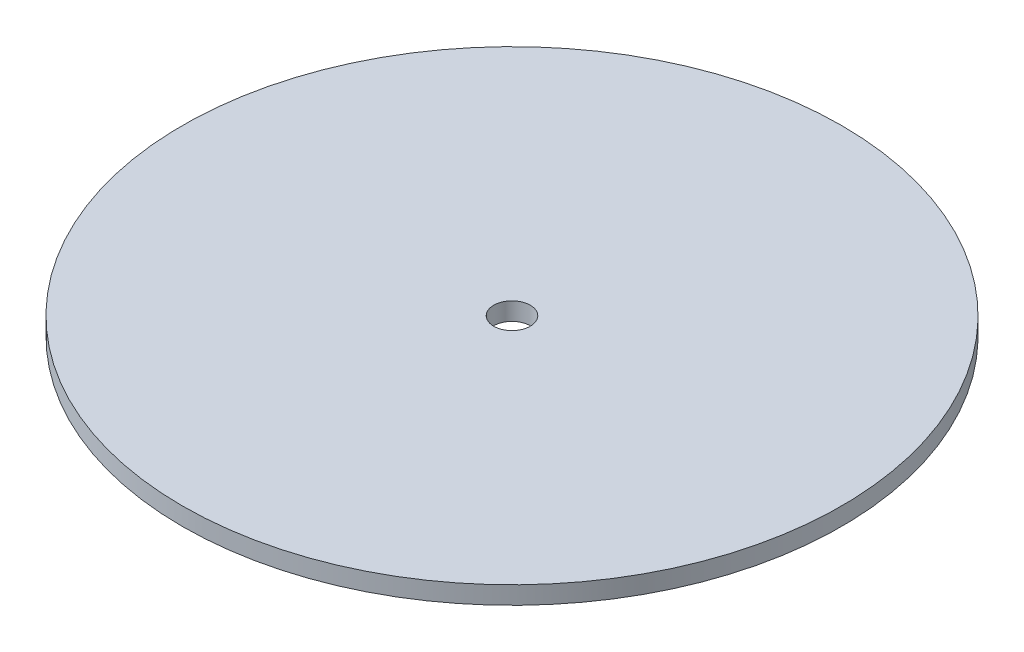
from build123d import *

# Parameters (mm, degrees)
SKETCH1_R           = 74.04
SKETCH1_R_2         = 4.1
BOSS_EXTRUDE1_DEPTH = 4


with BuildPart() as part:
    # Sketch1 → Boss-Extrude1 (new body)
    with BuildSketch(Plane(origin=(0, 0, 0), x_dir=(1, 0, 0), z_dir=(0, 1, 0))):
        with Locations(Location((0, 0, 0), (0, 0, 270))):
            Circle(SKETCH1_R)
        with Locations(Location((0, 0, 0), (0, 0, 270))):
            Circle(SKETCH1_R_2, mode=Mode.SUBTRACT)
    extrude(amount=BOSS_EXTRUDE1_DEPTH)


solid = part.part
